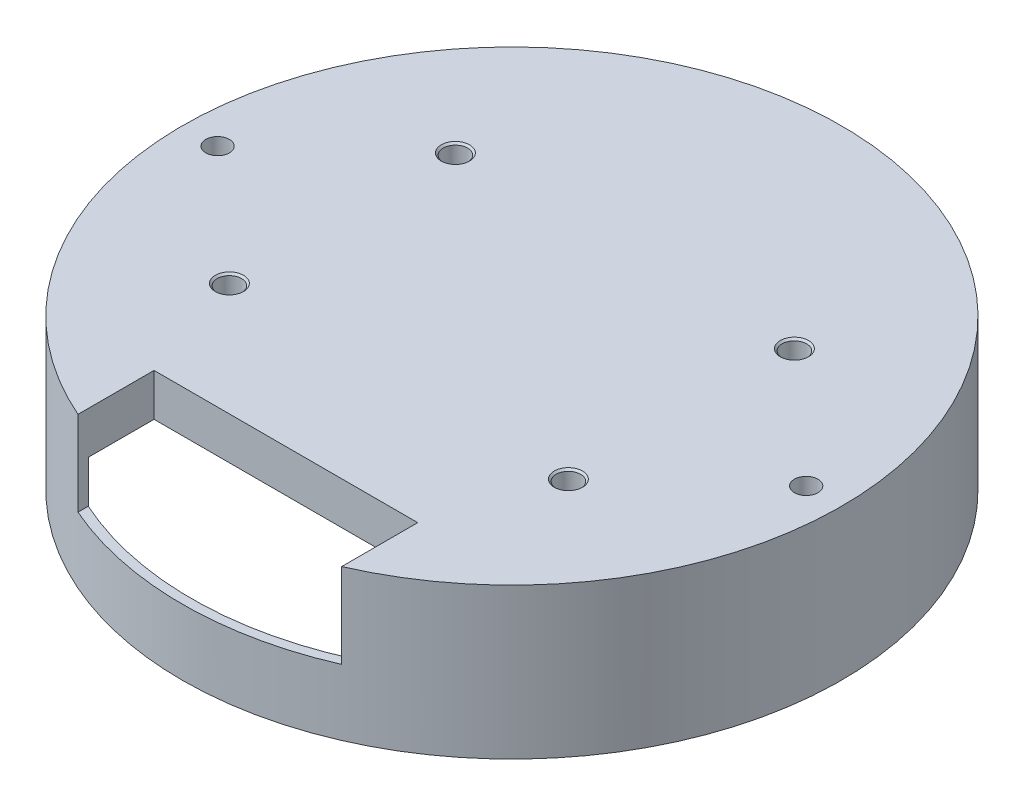
from build123d import *

# Parameters (mm, degrees)
SKETCH_1_R          = 35
EXTRUDE_1_DEPTH     = 16
SKETCH_2_R          = 34
CUT_EXTRUDE_1_DEPTH = 11.5
SKETCH_3_R          = 1.25
CUT_EXTRUDE_4_DEPTH = 16
CUT_EXTRUDE_START   = -9
CUT_EXTRUDE_5_DEPTH = 9
SKETCH_5_R          = 1.3
CUT_EXTRUDE_6_DEPTH = 2.5
CHAMFER_1_SIZE      = 0.2


with BuildPart() as part:
    # 草圖1 → 填料-伸長1 (new body)
    with BuildSketch(Plane(origin=(0, 0, 0), x_dir=(1, 0, 0), z_dir=(0, 1, 0))):
        with Locations(Location((0, 0, 0), (0, 0, 270))):
            Circle(SKETCH_1_R)
    extrude(amount=EXTRUDE_1_DEPTH)

    # 草圖2 → 除料-伸長1 (cut)
    with BuildSketch(Plane.XZ):
        with Locations(Location((0, 0, 0), (0, 0, 270))):
            Circle(SKETCH_2_R)
    extrude(amount=-CUT_EXTRUDE_1_DEPTH, mode=Mode.SUBTRACT)

    # 草圖3 → 除料-伸長4 (cut)
    with BuildSketch(Plane(origin=(0, 0, 0), x_dir=(1, 0, 0), z_dir=(0, 1, 0))):
        with Locations(Location((-31.25, 0, 0), (0, 0, 90))):
            Circle(SKETCH_3_R)
        with Locations(Location((31.25, 0, 0), (0, 0, 90))):
            Circle(SKETCH_3_R)
    extrude(amount=CUT_EXTRUDE_4_DEPTH, mode=Mode.SUBTRACT)

    # 草圖4 → 除料-伸長5 (cut)
    with BuildSketch(Plane(origin=(0, 16, 0), x_dir=(1, 0, 0), z_dir=(0, 1, 0)).offset(CUT_EXTRUDE_START)):
        with BuildLine():
            Line((-14, -24), (14, -24))
            Line((14, -24), (14, -32.078029865))
            ThreePointArc((14, -32.078029865), (0, -35), (-14, -32.078029865))
            Line((-14, -32.078029865), (-14, -24))
        make_face()
    extrude(amount=CUT_EXTRUDE_5_DEPTH, mode=Mode.SUBTRACT)

    # 草圖5 → 除料-伸長6 (cut)
    with BuildSketch(Plane(origin=(0, 16, 0), x_dir=(1, 0, 0), z_dir=(0, 1, 0))):
        with Locations(Location((-18, 12, 0), (0, 0, 270))):
            Circle(SKETCH_5_R)
        with Locations(Location((18, 12, 0), (0, 0, 270))):
            Circle(SKETCH_5_R)
        with Locations(Location((18, -12, 0), (0, 0, 270))):
            Circle(SKETCH_5_R)
        with Locations(Location((-18, -12, 0), (0, 0, 270))):
            Circle(SKETCH_5_R)
    extrude(amount=-CUT_EXTRUDE_6_DEPTH, mode=Mode.SUBTRACT)

    # 導角1
    chamfer_1_edges = [part.edges().sort_by_distance(p)[0] for p in [
        (-18, 16, 10.7),
        (18, 16, 10.7),
        (18, 16, -13.3),
        (-18, 16, -13.3),
    ]]
    chamfer(chamfer_1_edges, length=CHAMFER_1_SIZE)


solid = part.part
